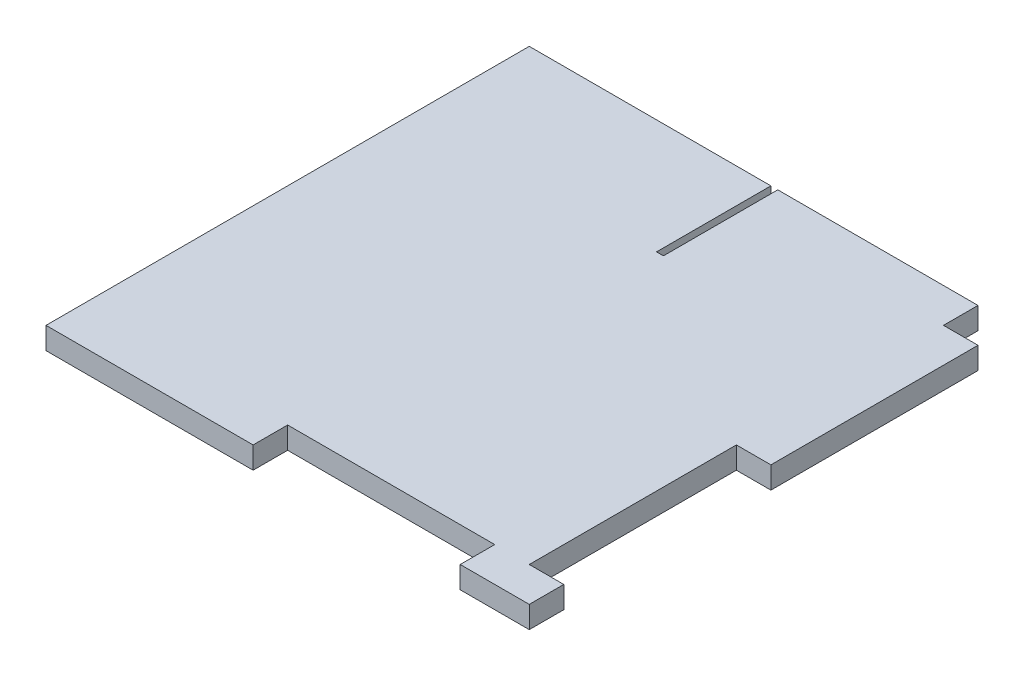
from build123d import *

# Parameters (mm, degrees)
SKETCH1_W           = 70
SKETCH1_H           = 70
BOSS_EXTRUDE1_DEPTH = 3.175
SKETCH2_W           = 1
SKETCH2_H           = 16.56370183
CUT_EXTRUDE1_DEPTH  = 3.175
SKETCH3_W           = 30
SKETCH3_H           = 5
SKETCH3_W_2         = 5
SKETCH3_H_2         = 30
CUT_EXTRUDE2_DEPTH  = 10


with BuildPart() as part:
    # Sketch1 → Boss-Extrude1 (new body)
    with BuildSketch(Plane(origin=(0, 0, 0), x_dir=(1, 0, 0), z_dir=(0, 1, 0))):
        Rectangle(SKETCH1_W, SKETCH1_H)
    extrude(amount=BOSS_EXTRUDE1_DEPTH)

    # Sketch2 → Cut-Extrude1 (cut)
    with BuildSketch(Plane(origin=(0, 3.175, 0), x_dir=(1, 0, 0), z_dir=(0, 1, 0))):
        with Locations((0.5, 26.718149085)):
            Rectangle(SKETCH2_W, SKETCH2_H)
    extrude(amount=-CUT_EXTRUDE1_DEPTH, mode=Mode.SUBTRACT)

    # Sketch3 → Cut-Extrude2 (cut)
    with BuildSketch(Plane(origin=(0, 3.175, 0), x_dir=(1, 0, 0), z_dir=(0, 1, 0))):
        with Locations((10, -32.5)):
            Rectangle(SKETCH3_W, SKETCH3_H)
        with Locations((32.5, -15)):
            Rectangle(SKETCH3_W_2, SKETCH3_H_2)
        with Locations((32.5, 32.5)):
            Rectangle(SKETCH3_W_2, SKETCH3_H)
    extrude(amount=-CUT_EXTRUDE2_DEPTH, mode=Mode.SUBTRACT)


solid = part.part
